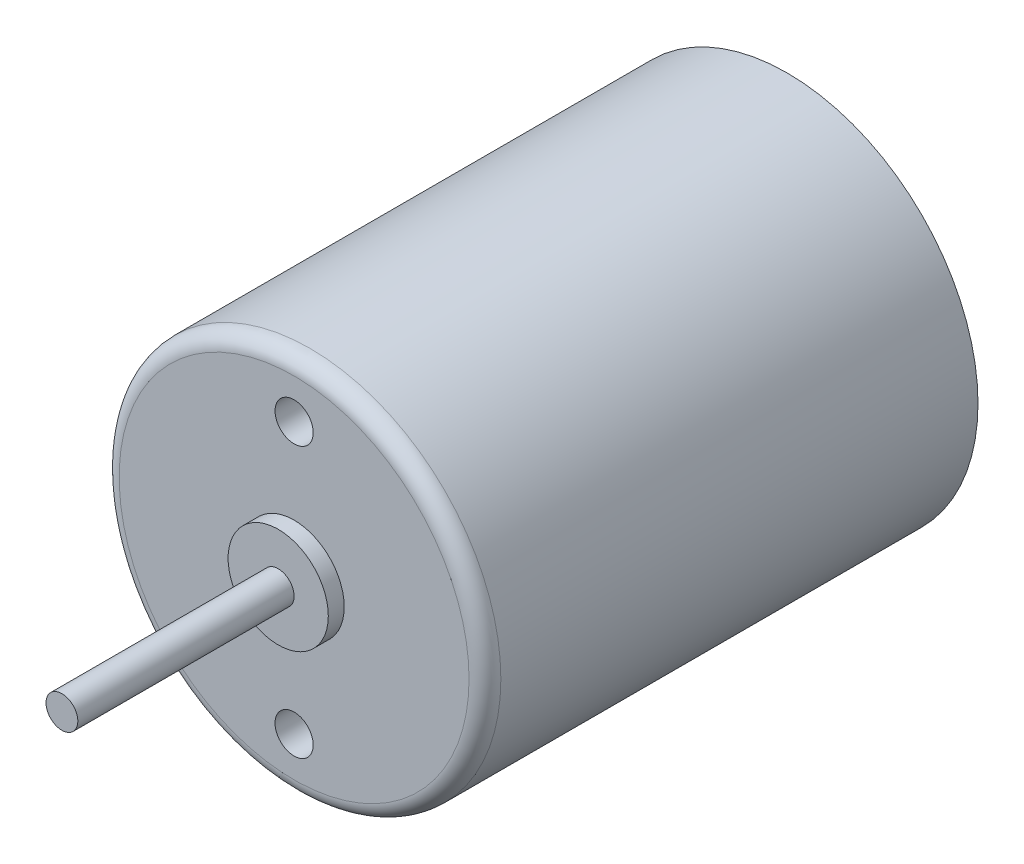
from build123d import *

# Parameters (mm, degrees)
SKETCH1_R           = 12
BOSS_EXTRUDE1_DEPTH = 31
FILLET1_R           = 1
SKETCH2_R           = 3.15
BOSS_EXTRUDE2_DEPTH = 1
SKETCH4_R           = 1
BOSS_EXTRUDE3_DEPTH = 45.6
SKETCH5_R           = 1.2
CUT_EXTRUDE1_DEPTH  = 3


with BuildPart() as part:
    # Sketch1 → Boss-Extrude1 (new body)
    with BuildSketch(Plane.XY):
        Circle(SKETCH1_R)
    extrude(amount=BOSS_EXTRUDE1_DEPTH)

    # Fillet1
    fillet1_edges = [part.edges().sort_by_distance(p)[0] for p in [
        (-12, 0, 31),
    ]]
    fillet(fillet1_edges, radius=FILLET1_R)

    # Sketch2 → Boss-Extrude2 (add)
    with BuildSketch(Plane.XY.offset(31)):
        Circle(SKETCH2_R)
    extrude(amount=BOSS_EXTRUDE2_DEPTH)

    # Sketch4 → Boss-Extrude3 (add)
    with BuildSketch(Plane(origin=(0, 0, 0), x_dir=(-1, 0, 0), z_dir=(0, 0, -1))):
        Circle(SKETCH4_R)
    extrude(amount=-BOSS_EXTRUDE3_DEPTH)

    # Sketch5 → Cut-Extrude1 (cut)
    with BuildSketch(Plane.XY.offset(31)):
        with Locations((0, -8.5)):
            Circle(SKETCH5_R)
    cut_extrude1 = extrude(amount=-CUT_EXTRUDE1_DEPTH, mode=Mode.SUBTRACT)

    # Mirror1: Cut-Extrude1 across plane
    add(cut_extrude1.mirror(Plane.ZX), mode=Mode.SUBTRACT)


solid = part.part
